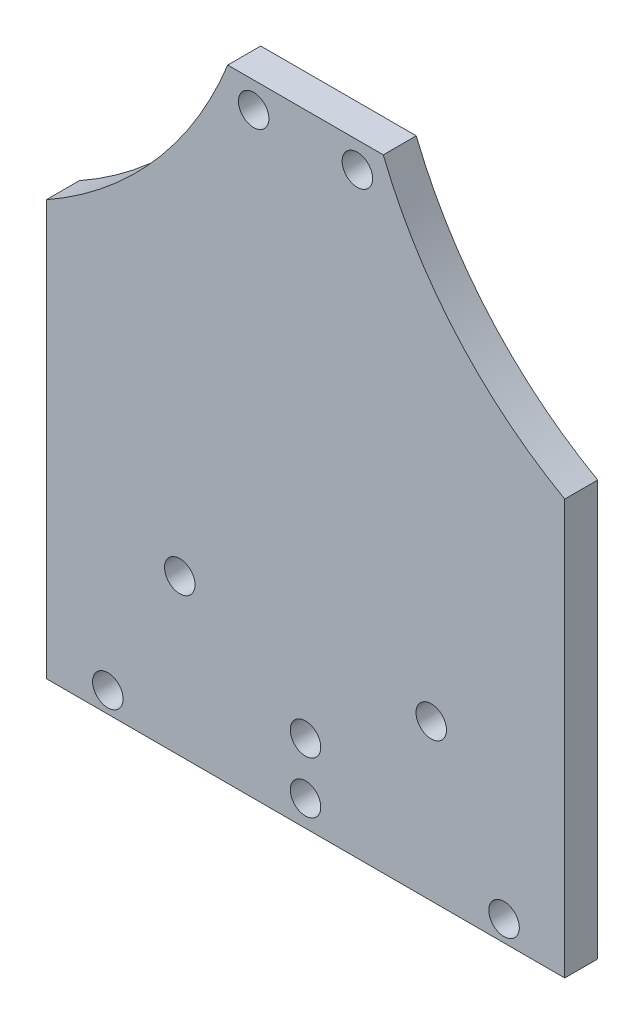
from build123d import *

# Parameters (mm, degrees)
SKETCH1_W           = 50
SKETCH1_H           = 30
SKETCH1_R           = 1.47
BOSS_EXTRUDE1_DEPTH = 3.18
BOSS_EXTRUDE2_DEPTH = 3.18
SKETCH3_R           = 1.47
CUT_EXTRUDE1_DEPTH  = 56.992074439
SKETCH4_R           = 1.47
CUT_EXTRUDE2_DEPTH  = 56.992074439


with BuildPart() as part:
    # Sketch1 → Boss-Extrude1 (new body)
    with BuildSketch(Plane.XY):
        with Locations((0, 5)):
            Rectangle(SKETCH1_W, SKETCH1_H)
        with Locations(Location((-12.125, 5, 0), (0, 0, 180))):
            Circle(SKETCH1_R, mode=Mode.SUBTRACT)
        with Locations(Location((12.125, 5, 0), (0, 0, 180))):
            Circle(SKETCH1_R, mode=Mode.SUBTRACT)
    extrude(amount=BOSS_EXTRUDE1_DEPTH)

    # Sketch2 → Boss-Extrude2 (add)
    with BuildSketch(Plane(origin=(0, 0, 0), x_dir=(-1, 0, 0), z_dir=(0, 0, -1))):
        with BuildLine():
            Line((-25, 20), (25, 20))
            Line((25, 20), (25, 30))
            ThreePointArc((25, 30), (14.540499974, 38.504187477), (7.5, 50))
            Line((7.5, 50), (-7.5, 50))
            ThreePointArc((-7.5, 50), (-14.540499974, 38.504187477), (-25, 30))
            Line((-25, 30), (-25, 20))
        make_face()
    extrude(amount=-BOSS_EXTRUDE2_DEPTH)

    # Sketch3 → Cut-Extrude1 (cut, through all)
    with BuildSketch(Plane(origin=(0, 0, 0), x_dir=(-1, 0, 0), z_dir=(0, 0, -1))):
        with Locations((-5, 47.5)):
            Circle(SKETCH3_R)
        with Locations((5, 47.5)):
            Circle(SKETCH3_R)
    extrude(amount=-CUT_EXTRUDE1_DEPTH, mode=Mode.SUBTRACT)

    # Sketch4 → Cut-Extrude2 (cut, through all)
    with BuildSketch(Plane(origin=(0, 0, 0), x_dir=(-1, 0, 0), z_dir=(0, 0, -1))):
        with Locations((0, -7.5)):
            Circle(SKETCH4_R)
        with Locations((-19.1461, -8)):
            Circle(SKETCH4_R)
        with Locations((0, -2.5)):
            Circle(SKETCH4_R)
        with Locations((19.0639, -8)):
            Circle(SKETCH4_R)
    extrude(amount=-CUT_EXTRUDE2_DEPTH, mode=Mode.SUBTRACT)


solid = part.part
